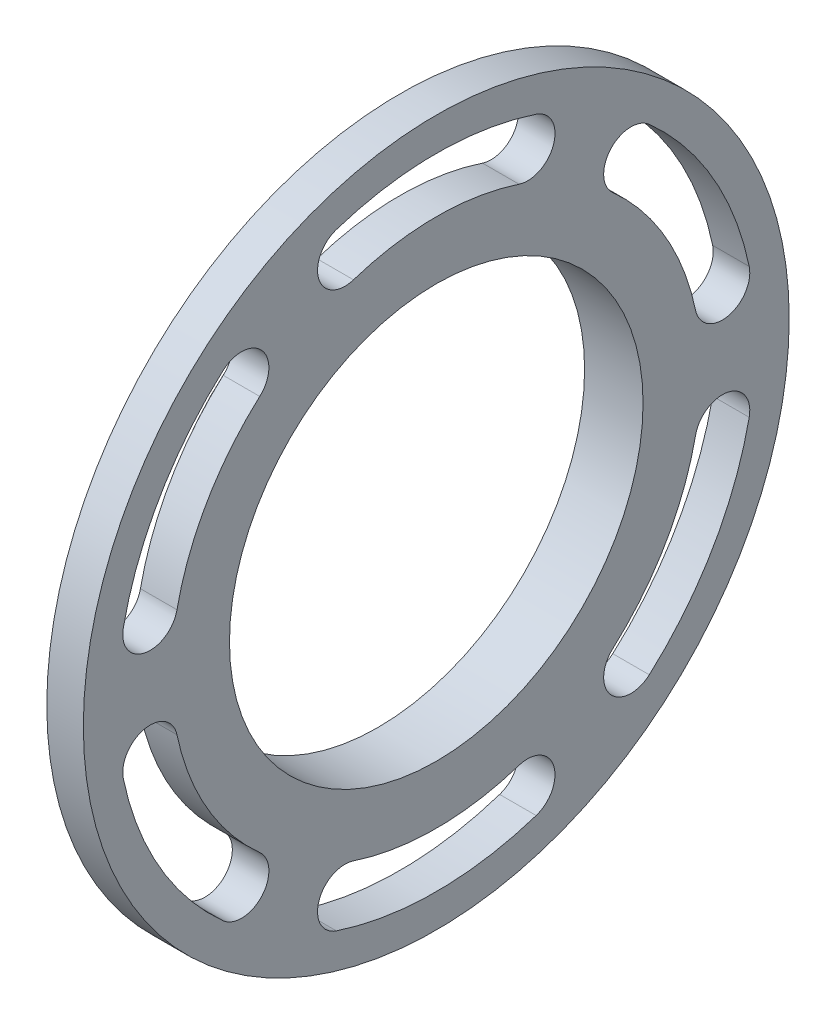
from build123d import *

# Parameters (mm, degrees)
CUT_EXTRUDE1_DEPTH = 87.981371925
CIRPATTERN1_COUNT  = 6


with BuildPart() as part:
    # Sketch2 → Revolve1 (revolve)
    with BuildSketch(Plane.XY, mode=Mode.PRIVATE) as revolve1_sk:
        Polygon((0, 35.941), (6.35, 35.941), (6.35, 61.341), (0, 61.341), (0, 40.7035), (-3.81, 40.7035), (-3.81, 35.941), align=None)
    revolve(revolve1_sk.sketch.rotate(Axis((88.99, 0, 0), (-1, 0, 0)), 90), axis=Axis((88.99, 0, 0), (-1, 0, 0)))

    # Sketch3 → Cut-Extrude1 (cut, through all)
    with BuildSketch(Plane(origin=(0, 0, 0), x_dir=(0, 0, -1), z_dir=(1, 0, 0))):
        with BuildLine():
            ThreePointArc((17.36328125, 52.779805518), (0, 55.5625), (-17.36328125, 52.779805518))
            ThreePointArc((-17.36328125, 52.779805518), (-20.39898333, 46.767540938), (-14.38671875, 43.731838858))
            ThreePointArc((-14.38671875, 43.731838858), (0, 46.0375), (14.38671875, 43.731838858))
            ThreePointArc((14.38671875, 43.731838858), (20.39898333, 46.767540938), (17.36328125, 52.779805518))
        make_face()
    cut_extrude1 = extrude(amount=CUT_EXTRUDE1_DEPTH, mode=Mode.SUBTRACT)

    # CirPattern1: Cut-Extrude1 ×6 about axis
    cirpattern1_axis = Axis((0, 0, 0), (1, 0, 0))
    for i in range(1, CIRPATTERN1_COUNT):
        add(cut_extrude1.rotate(cirpattern1_axis, i * 360 / CIRPATTERN1_COUNT), mode=Mode.SUBTRACT)


solid = part.part
